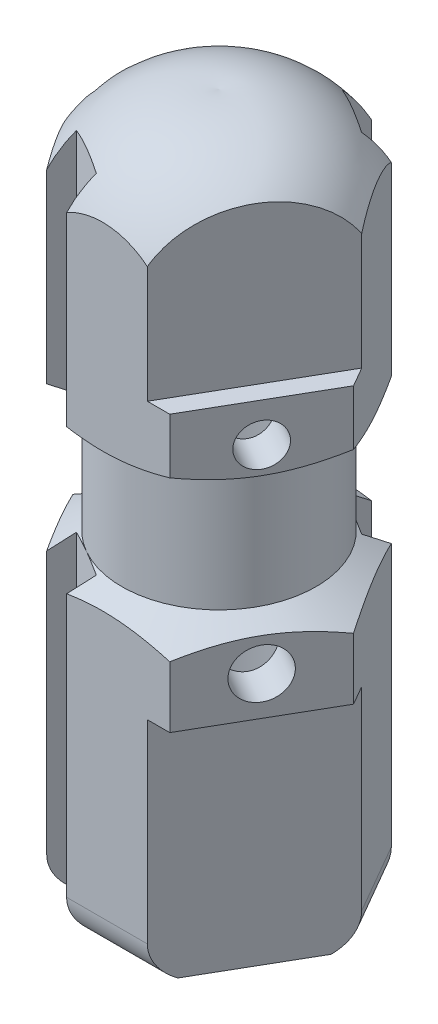
from build123d import *

# Parameters (mm, degrees)
BOSS_EXTRUDE1_DEPTH              = 57.15
FILLET1_R                        = 3.175
F_1_2_0_5_DIAMETER_HOLE1_D       = 12.7
F_1_2_0_5_DIAMETER_HOLE1_DEPTH   = 45.72
F_1_2_0_5_DIAMETER_HOLE1_TIP     = 3.815464931
F_10_32_TAPPED_HOLE1_REACH       = 63.974
F_10_32_TAPPED_HOLE1_BORE_R      = 2.0193
F_29_0_136_DIAMETER_HOLE1_REACH  = 63.974
F_29_0_136_DIAMETER_HOLE1_BORE_R = 1.7272
CUT_EXTRUDE1_DEPTH               = 59.973007694
CIRPATTERN1_COUNT                = 6
SKETCH16_W                       = 25.4
SKETCH16_H                       = 25.4
CUT_EXTRUDE2_DEPTH               = 1.5875


with BuildPart() as part:
    # Sketch1 → Boss-Extrude1 (new body)
    with BuildSketch(Plane(origin=(0, 0, 0), x_dir=(1, 0, 0), z_dir=(0, 1, 0))):
        Polygon((10.998522628, 0), (5.499261314, 9.525), (-5.499261314, 9.525), (-10.998522628, 0), (-5.499261314, -9.525), (5.499261314, -9.525), align=None)
    extrude(amount=BOSS_EXTRUDE1_DEPTH)

    # Fillet1
    fillet1_edges = [part.edges().sort_by_distance(p)[0] for p in [
        (0, 0, 9.525),
        (-8.248891971, 0, 4.7625),
        (-8.248891971, 0, -4.7625),
        (0, 0, -9.525),
        (8.248891971, 0, -4.7625),
        (8.248891971, 0, 4.7625),
    ]]
    fillet(fillet1_edges, radius=FILLET1_R)

    # 1/2 (0.5) Diameter Hole1
    with Locations(Plane(origin=(0, 0, 0), x_dir=(-1, 0, 0), z_dir=(0, -1, 0))):
        with Locations((0, 0)):
            Hole(F_1_2_0_5_DIAMETER_HOLE1_D / 2, depth=F_1_2_0_5_DIAMETER_HOLE1_DEPTH)
            with Locations((0, 0, -(F_1_2_0_5_DIAMETER_HOLE1_DEPTH + F_1_2_0_5_DIAMETER_HOLE1_TIP / 2))):  # 118° drill point
                Cone(0, F_1_2_0_5_DIAMETER_HOLE1_D / 2, F_1_2_0_5_DIAMETER_HOLE1_TIP, mode=Mode.SUBTRACT)

    # #10-32 Tapped Hole1 bore → #10-32 Tapped Hole1 (cut, up to next)
    with BuildSketch(Plane(origin=(8.248891971, 0, 4.7625), x_dir=(0.49999999999999845, 0, -0.8660254037844396), z_dir=(0.8660254037844395, 0, 0.4999999999999984)), mode=Mode.PRIVATE) as f_10_32_tapped_hole1_sk1:
        with Locations((0, 22.225)):
            Circle(F_10_32_TAPPED_HOLE1_BORE_R)
    f_10_32_tapped_hole1_tool1 = extrude(f_10_32_tapped_hole1_sk1.sketch, amount=-F_10_32_TAPPED_HOLE1_REACH, mode=Mode.PRIVATE) & part.part
    add(f_10_32_tapped_hole1_tool1.solids().sort_by_distance((8.248892, 22.225, 4.7625))[0], mode=Mode.SUBTRACT)

    # #29 (0.136) Diameter Hole1 bore → #29 (0.136) Diameter Hole1 (cut, up to next)
    with BuildSketch(Plane(origin=(8.248891971, 0, 4.7625), x_dir=(0.49999999999999845, 0, -0.8660254037844396), z_dir=(0.8660254037844395, 0, 0.4999999999999984)), mode=Mode.PRIVATE) as f_29_0_136_diameter_hole1_sk1:
        with Locations((0, 38.4175)):
            Circle(F_29_0_136_DIAMETER_HOLE1_BORE_R)
    f_29_0_136_diameter_hole1_tool1 = extrude(f_29_0_136_diameter_hole1_sk1.sketch, amount=-F_29_0_136_DIAMETER_HOLE1_REACH, mode=Mode.PRIVATE) & part.part
    add(f_29_0_136_diameter_hole1_tool1.solids().sort_by_distance((8.248892, 38.4175, 4.7625))[0], mode=Mode.SUBTRACT)

    # Sketch13 → Cut-Extrude1 (cut, through all)
    with BuildSketch(Plane(origin=(0, 57.15, 0), x_dir=(1, 0, 0), z_dir=(0, 1, 0))):
        Polygon((-9.06849146, 11.262087957), (-5.89349146, 5.762826643), (-2.04400854, 7.985326643), (-5.21900854, 13.484587957), align=None)
    cut_extrude1 = extrude(amount=-CUT_EXTRUDE1_DEPTH, mode=Mode.SUBTRACT)

    # CirPattern1: Cut-Extrude1 ×6 about axis, 2 skipped
    cirpattern1_axis = Axis((0, 0, 0), (0, -1, 0))
    add([cut_extrude1.rotate(cirpattern1_axis, i * 360 / CIRPATTERN1_COUNT) for i in range(1, CIRPATTERN1_COUNT) if i not in (2, 3)], mode=Mode.SUBTRACT)

    # Sketch15 → Cut-Revolve4 (revolve, cut)
    with BuildSketch(Plane.XY, mode=Mode.PRIVATE) as cut_revolve4_sk:
        with BuildLine():
            Line((-10.998522628, 47.244), (-21.751479805, 47.244))
            Line((-21.751479805, 47.244), (-21.751479805, 61.468889452))
            Line((-21.751479805, 61.468889452), (0, 61.468889452))
            Line((0, 61.468889452), (0, 57.08956907))
            ThreePointArc((0, 57.08956907), (-7.699575937, 54.624764363), (-10.998522628, 47.244))
        make_face()
    revolve(cut_revolve4_sk.sketch.rotate(Axis((0, 61.468889452, 0), (0, -1, 0)), 90), axis=Axis((0, 61.468889452, 0), (0, -1, 0)), mode=Mode.SUBTRACT)

    # Sketch12 → Cut-Revolve6 (revolve, cut)
    with BuildSketch(Plane.XY, mode=Mode.PRIVATE) as cut_revolve6_sk:
        Polygon((7.9375, 35.316717762), (10.998522628, 37.084), (10.998522628, 24.0665), (7.9375, 25.833782238), align=None)
    revolve(cut_revolve6_sk.sketch.rotate(Axis((0, 0, 0), (0, 1, 0)), 90), axis=Axis((0, 0, 0), (0, 1, 0)), mode=Mode.SUBTRACT)

    # Sketch16 → Cut-Extrude2 (cut)
    with BuildSketch(Plane(origin=(8.248891971, 0, 4.7625), x_dir=(0.49999999999999845, 0, -0.8660254037844396), z_dir=(0.8660254037844395, 0, 0.4999999999999984))):
        with Locations((0, 54.2925)):
            Rectangle(SKETCH16_W, SKETCH16_H)
        with Locations((0, 6.35)):
            Rectangle(SKETCH16_W, SKETCH16_H)
    extrude(amount=-CUT_EXTRUDE2_DEPTH, mode=Mode.SUBTRACT)


solid = part.part
